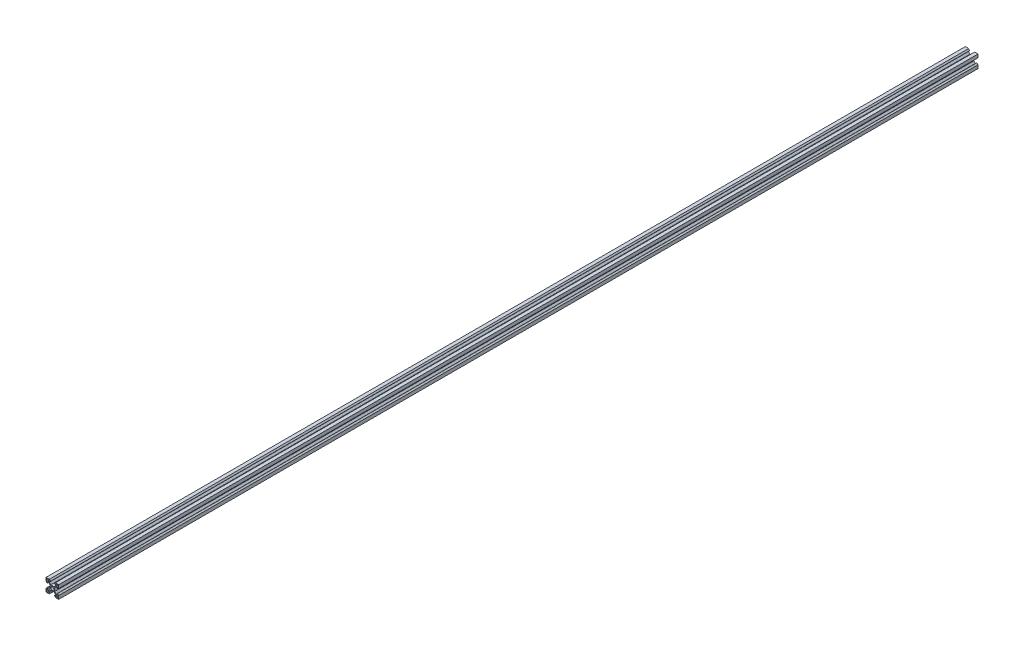
from build123d import *

# Parameters (mm, degrees)
SKETCH_1_R      = 2.5
SKETCH_1_W      = 3.3
SKETCH_1_H      = 3.3
EXTRUDE_1_DEPTH = 1445


with BuildPart() as part:
    # Эскиз1 → Бобышка-Вытянуть1 (new body)
    with BuildSketch(Plane.XY):
        Polygon((-10, 10), (-4.75, 10), (-3.1, 8), (-4.95, 8), (-4.95, 5.85), (-2.6, 3.5), (2.6, 3.5), (4.95, 5.85), (4.95, 8), (3.1, 8), (4.75, 10), (10, 10), (10, 4.75), (8, 3.1), (8, 4.95), (5.85, 4.95), (3.5, 2.6), (3.5, -2.6), (5.85, -4.95), (8, -4.95), (8, -3.1), (10, -4.75), (10, -10), (4.75, -10), (3.1, -8), (4.95, -8), (4.95, -5.85), (2.6, -3.5), (-2.6, -3.5), (-4.95, -5.85), (-4.95, -8), (-3.1, -8), (-4.75, -10), (-10, -10), (-10, -4.75), (-8, -3.1), (-8, -4.95), (-5.85, -4.95), (-3.5, -2.6), (-3.5, 2.6), (-5.85, 4.95), (-8, 4.95), (-8, 3.1), (-10, 4.75), align=None)
        Circle(SKETCH_1_R, mode=Mode.SUBTRACT)
        with Locations((-7.5, 7.5)):
            Rectangle(SKETCH_1_W, SKETCH_1_H, mode=Mode.SUBTRACT)
        with Locations((7.5, 7.5)):
            Rectangle(SKETCH_1_W, SKETCH_1_H, mode=Mode.SUBTRACT)
        with Locations((7.5, -7.5)):
            Rectangle(SKETCH_1_W, SKETCH_1_H, mode=Mode.SUBTRACT)
        with Locations((-7.5, -7.5)):
            Rectangle(SKETCH_1_W, SKETCH_1_H, mode=Mode.SUBTRACT)
    extrude(amount=-EXTRUDE_1_DEPTH)


solid = part.part
